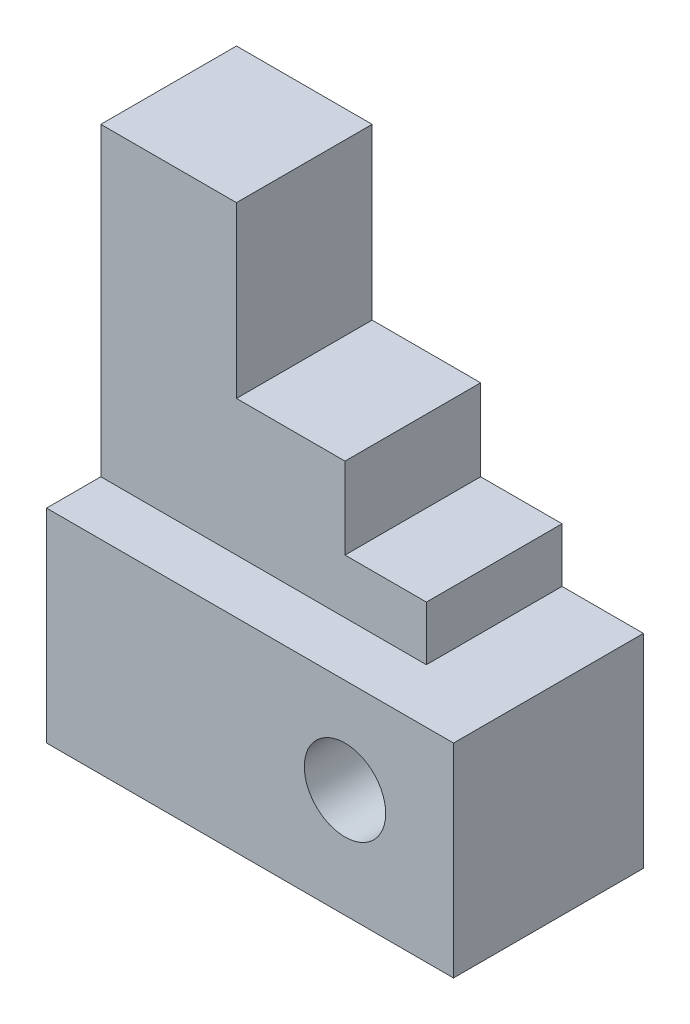
from build123d import *

# Parameters (mm, degrees)
SZKIC2_W                    = 60
SZKIC2_H                    = 30
SZKIC2_R                    = 6
DODANIE_WYCI_GNI_CIE1_DEPTH = 28
DODANIE_WYCI_GNI_CIE2_DEPTH = 20


with BuildPart() as part:
    # Szkic2 → Dodanie-wyciągnięcie1 (new body)
    with BuildSketch(Plane.XY):
        with Locations((30, 15)):
            Rectangle(SZKIC2_W, SZKIC2_H)
        with Locations((44, 16)):
            Circle(SZKIC2_R, mode=Mode.SUBTRACT)
    extrude(amount=DODANIE_WYCI_GNI_CIE1_DEPTH)

    # Szkic4 → Dodanie-wyciągnięcie2 (add)
    with BuildSketch(Plane.XY):
        Polygon((0, 30), (0, 75), (20, 75), (20, 50), (36, 50), (36, 38), (48, 38), (48, 30), align=None)
    extrude(amount=DODANIE_WYCI_GNI_CIE2_DEPTH)


solid = part.part
